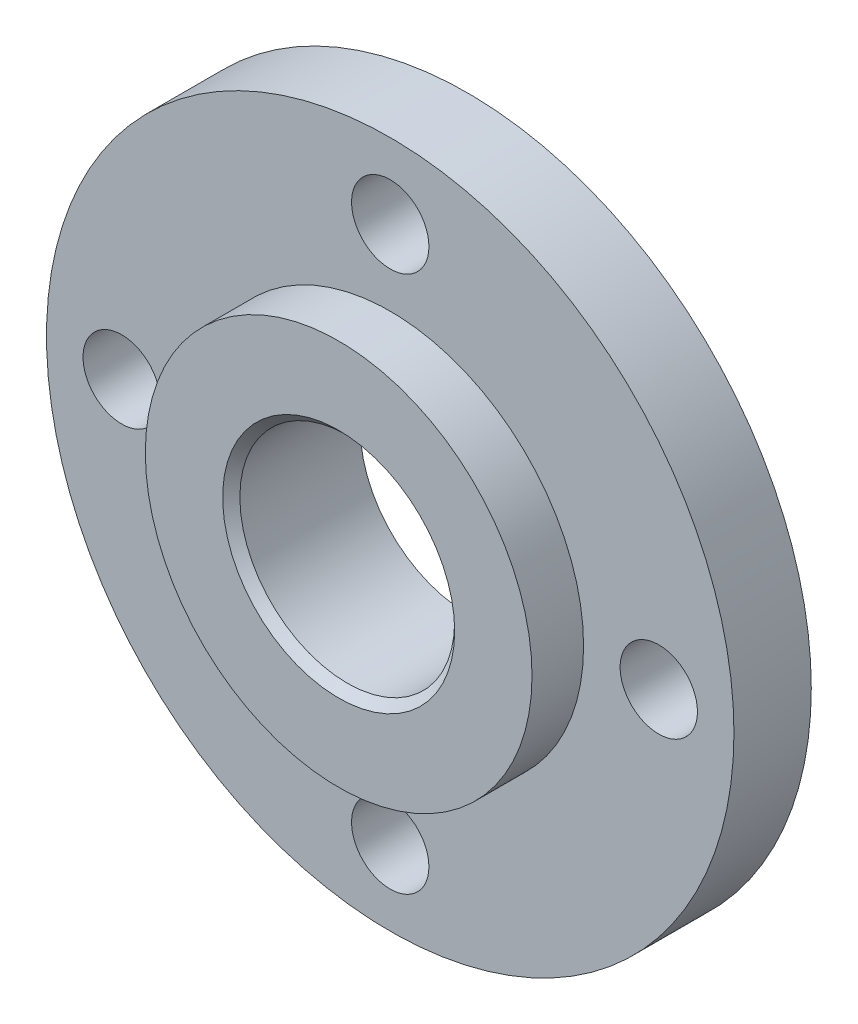
from build123d import *

# Parameters (mm, degrees)
SKETCH_1_R          = 80
EXTRUDE_1_DEPTH     = 18
SKETCH_2_R          = 45
EXTRUDE_2_DEPTH     = 30
SKETCH_3_R          = 25
CUT_EXTRUDE_1_DEPTH = 118.046999107
SKETCH_4_R          = 9
CUT_EXTRUDE_2_DEPTH = 118.046999107
CHAMFER_1_SIZE      = 2


with BuildPart() as part:
    # 草图1 → 凸台-拉伸1 (new body)
    with BuildSketch(Plane.XY):
        Circle(SKETCH_1_R)
    extrude(amount=EXTRUDE_1_DEPTH)

    # 草图2 → 凸台-拉伸2 (add)
    with BuildSketch(Plane.XY):
        Circle(SKETCH_2_R)
    extrude(amount=EXTRUDE_2_DEPTH)

    # 草图3 → 切除-拉伸1 (cut, through all)
    with BuildSketch(Plane.XY):
        Circle(SKETCH_3_R)
    extrude(amount=CUT_EXTRUDE_1_DEPTH, mode=Mode.SUBTRACT)

    # 草图4 → 切除-拉伸2 (cut, through all)
    with BuildSketch(Plane.XY):
        with Locations((62.5, 0)):
            Circle(SKETCH_4_R)
        with Locations((0, 62.5)):
            Circle(SKETCH_4_R)
        with Locations((-62.5, 0)):
            Circle(SKETCH_4_R)
        with Locations((0, -62.5)):
            Circle(SKETCH_4_R)
    extrude(amount=CUT_EXTRUDE_2_DEPTH, mode=Mode.SUBTRACT)

    # 倒角1
    chamfer_1_edges = [part.edges().sort_by_distance(p)[0] for p in [
        (-25, 0, 30),
    ]]
    chamfer(chamfer_1_edges, length=CHAMFER_1_SIZE)


solid = part.part
